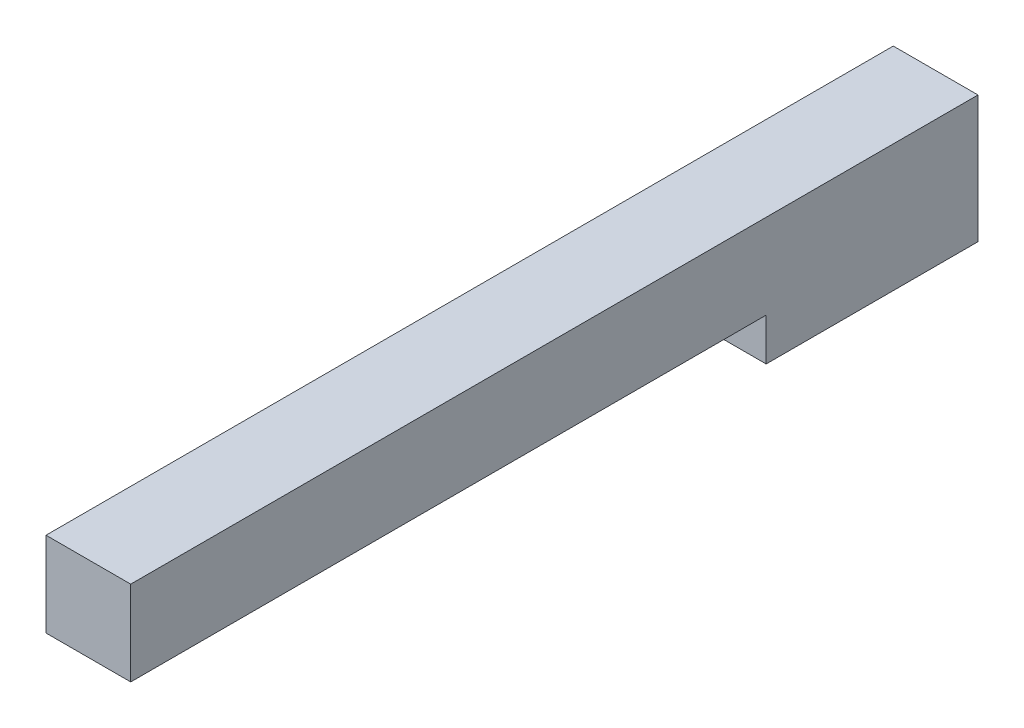
from build123d import *

# Parameters (mm, degrees)
CROQUIS11_W             = 4
CROQUIS11_H             = 6
SALIENTE_EXTRUIR5_DEPTH = 10
CROQUIS12_W             = 4
CROQUIS12_H             = 4
SALIENTE_EXTRUIR6_DEPTH = 30


with BuildPart() as part:
    # Croquis11 → Saliente-Extruir5 (new body)
    with BuildSketch(Plane.XY):
        Rectangle(CROQUIS11_W, CROQUIS11_H)
    extrude(amount=SALIENTE_EXTRUIR5_DEPTH)

    # Croquis12 → Saliente-Extruir6 (add)
    with BuildSketch(Plane.XY.offset(10)):
        with Locations((0, 1)):
            Rectangle(CROQUIS12_W, CROQUIS12_H)
    extrude(amount=SALIENTE_EXTRUIR6_DEPTH)


solid = part.part
